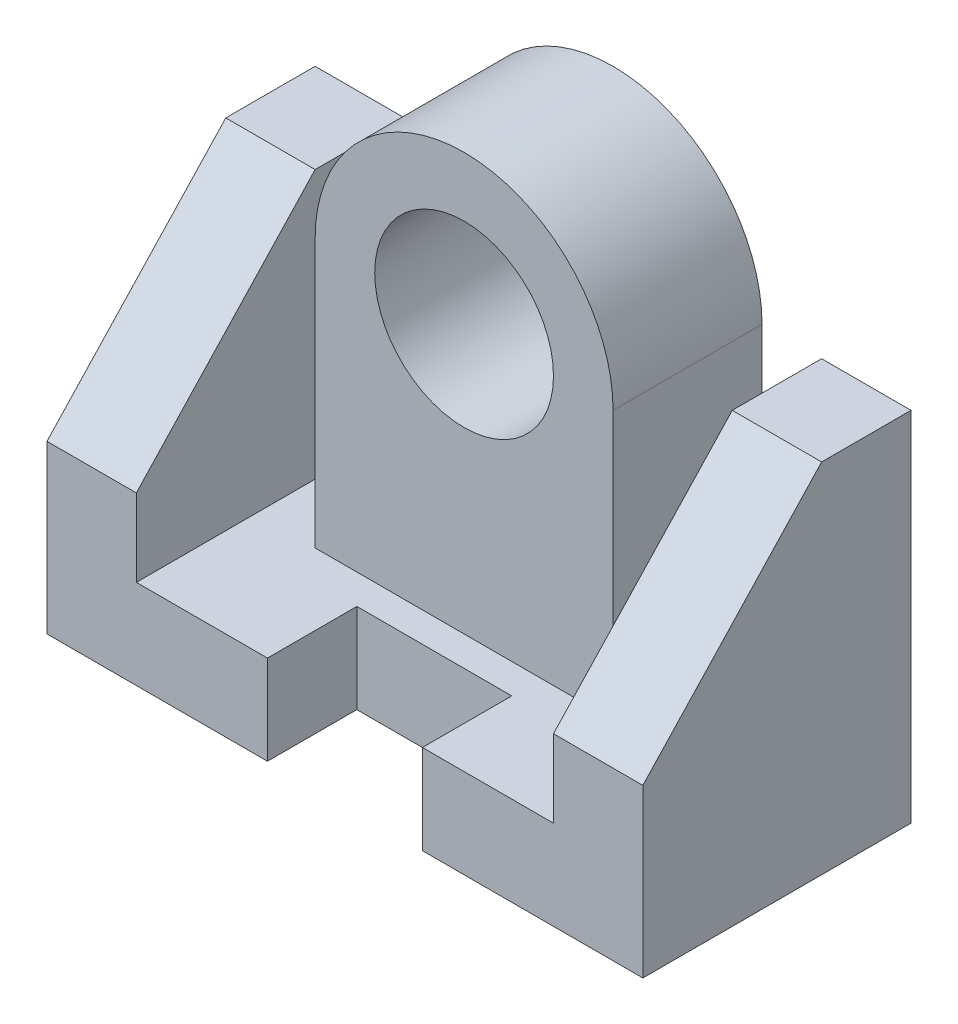
from build123d import *

# Parameters (mm, degrees)
BOSS_EXTRUDE1_DEPTH = 45
CUT_EXTRUDE1_DEPTH  = 126
SKETCH3_W           = 26
SKETCH3_H           = 15
CUT_EXTRUDE2_DEPTH  = 81.932070281
BOSS_EXTRUDE2_DEPTH = 25
SKETCH5_R           = 15
CUT_EXTRUDE3_DEPTH  = 102.734949747


with BuildPart() as part:
    # Sketch1 → Boss-Extrude1 (new body)
    with BuildSketch(Plane.XY):
        Polygon((-50, 0), (-50, 60), (-35, 60), (-35, 15), (35, 15), (35, 60), (50, 60), (50, 0), align=None)
    extrude(amount=BOSS_EXTRUDE1_DEPTH)

    # Sketch2 → Cut-Extrude1 (cut, through all)
    with BuildSketch(Plane(origin=(50, 0, 0), x_dir=(0, 0, -1), z_dir=(1, 0, 0))):
        Polygon((-15, 60), (-45, 60), (-45, 28), align=None)
    extrude(amount=-CUT_EXTRUDE1_DEPTH, mode=Mode.SUBTRACT)

    # Sketch3 → Cut-Extrude2 (cut, through all)
    with BuildSketch(Plane(origin=(0, 15, 0), x_dir=(1, 0, 0), z_dir=(0, 1, 0))):
        with Locations((0, -37.5)):
            Rectangle(SKETCH3_W, SKETCH3_H)
    extrude(amount=-CUT_EXTRUDE2_DEPTH, mode=Mode.SUBTRACT)

    # Sketch4 → Boss-Extrude2 (add)
    with BuildSketch(Plane(origin=(0, 0, 0), x_dir=(-1, 0, 0), z_dir=(0, 0, -1))):
        with BuildLine():
            Line((25, 15), (25, 60))
            ThreePointArc((25, 60), (0, 85), (-25, 60))
            Line((-25, 60), (-25, 15))
            Line((-25, 15), (25, 15))
        make_face()
    extrude(amount=-BOSS_EXTRUDE2_DEPTH)

    # Sketch5 → Cut-Extrude3 (cut, through all)
    with BuildSketch(Plane.XY.offset(25)):
        with Locations((0, 60)):
            Circle(SKETCH5_R)
    extrude(amount=-CUT_EXTRUDE3_DEPTH, mode=Mode.SUBTRACT)


solid = part.part
